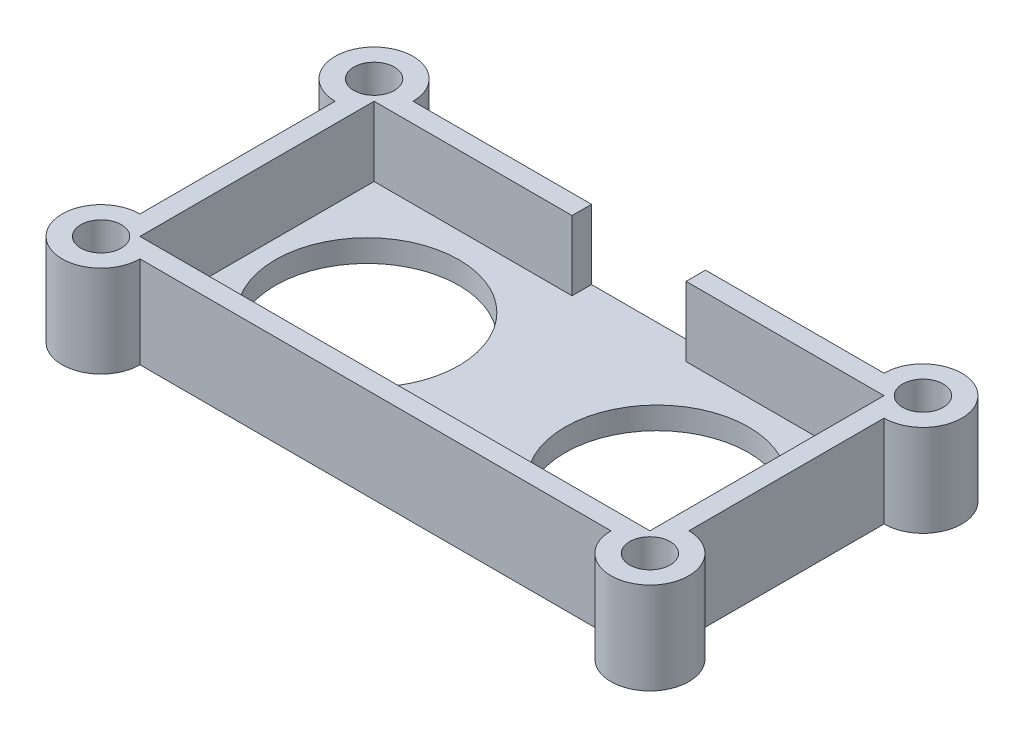
from build123d import *

# Parameters (mm, degrees)
SKETCH1_W               = 49.35
SKETCH1_H               = 24.55
BOSS_EXTRUDE1_DEPTH     = 2
BOSS_EXTRUDE2_DEPTH     = 6.25
BOSS_EXTRUDE3_START     = -2
BOSS_EXTRUDE3_DEPTH     = 8.25
CUT_EXTRUDE1_DEPTH      = 33.889873061
CUT_EXTRUDE1_DEPTH_BACK = 33.889873061
SKETCH3_R               = 8.25
SKETCH3_R_2             = 1.825


with BuildPart() as part:
    # Sketch1 → Boss-Extrude1 (new body)
    with BuildSketch(Plane(origin=(0, 0, 0), x_dir=(1, 0, 0), z_dir=(0, 1, 0))):
        Rectangle(SKETCH1_W, SKETCH1_H)
    extrude(amount=BOSS_EXTRUDE1_DEPTH)

    # Sketch2 → Boss-Extrude2 (add)
    with BuildSketch(Plane(origin=(0, 2, 0), x_dir=(1, 0, 0), z_dir=(0, 1, 0))):
        Polygon((-24.675, 12.275), (-24.675, -12.275), (24.675, -12.275), (24.675, 12.275), (5.125, 12.275), (5.125, 10.525), (22.925, 10.525), (22.925, -10.525), (-22.925, -10.525), (-22.925, 10.525), (-5.125, 10.525), (-5.125, 12.275), align=None)
    extrude(amount=BOSS_EXTRUDE2_DEPTH)

    # Sketch4 → Boss-Extrude3 (add)
    with BuildSketch(Plane(origin=(0, 2, 0), x_dir=(1, 0, 0), z_dir=(0, 1, 0)).offset(BOSS_EXTRUDE3_START)):
        with BuildLine():
            Line((-24.675, 12.275), (-24.675, 8.775))
            ThreePointArc((-24.675, 8.775), (-27.149873734, 14.749873734), (-21.175, 12.275))
            Line((-21.175, 12.275), (-24.675, 12.275))
        make_face()
        with BuildLine():
            Line((-24.675, -12.275), (-24.675, -8.775))
            ThreePointArc((-24.675, -8.775), (-27.149873734, -14.749873734), (-21.175, -12.275))
            Line((-21.175, -12.275), (-24.675, -12.275))
        make_face()
        with BuildLine():
            Line((24.675, -12.275), (21.175, -12.275))
            ThreePointArc((21.175, -12.275), (27.149873734, -14.749873734), (24.675, -8.775))
            Line((24.675, -8.775), (24.675, -12.275))
        make_face()
        with BuildLine():
            Line((24.675, 8.775), (24.675, 12.275))
            Line((24.675, 12.275), (21.175, 12.275))
            ThreePointArc((21.175, 12.275), (27.149873734, 14.749873734), (24.675, 8.775))
        make_face()
    extrude(amount=BOSS_EXTRUDE3_DEPTH)

    # Sketch3 → Cut-Extrude1 (cut, two sides: drawn at the far end of the back side and taken through both)
    with BuildSketch(Plane(origin=(0, 2, 0), x_dir=(1, 0, 0), z_dir=(0, 1, 0)).offset(-CUT_EXTRUDE1_DEPTH_BACK)):
        with Locations(Location((-13.025, 0, 0), (0, 0, 270))):
            Circle(SKETCH3_R)
        with Locations(Location((13.025, 0, 0), (0, 0, 270))):
            Circle(SKETCH3_R)
        with Locations(Location((-24.675, 12.275, 0), (0, 0, 270))):
            Circle(SKETCH3_R_2)
        with Locations(Location((-24.675, -12.275, 0), (0, 0, 270))):
            Circle(SKETCH3_R_2)
        with Locations(Location((24.675, 12.275, 0), (0, 0, 270))):
            Circle(SKETCH3_R_2)
        with Locations(Location((24.675, -12.275, 0), (0, 0, 270))):
            Circle(SKETCH3_R_2)
        with BuildLine():
            Line((-3, -4.975), (3.25, -4.975))
            ThreePointArc((3.25, -4.975), (5.625, -7.35), (3.25, -9.725))
            Line((3.25, -9.725), (-3, -9.725))
            ThreePointArc((-3, -9.725), (-5.375, -7.35), (-3, -4.975))
        make_face()
    extrude(amount=CUT_EXTRUDE1_DEPTH + CUT_EXTRUDE1_DEPTH_BACK, mode=Mode.SUBTRACT)


solid = part.part
